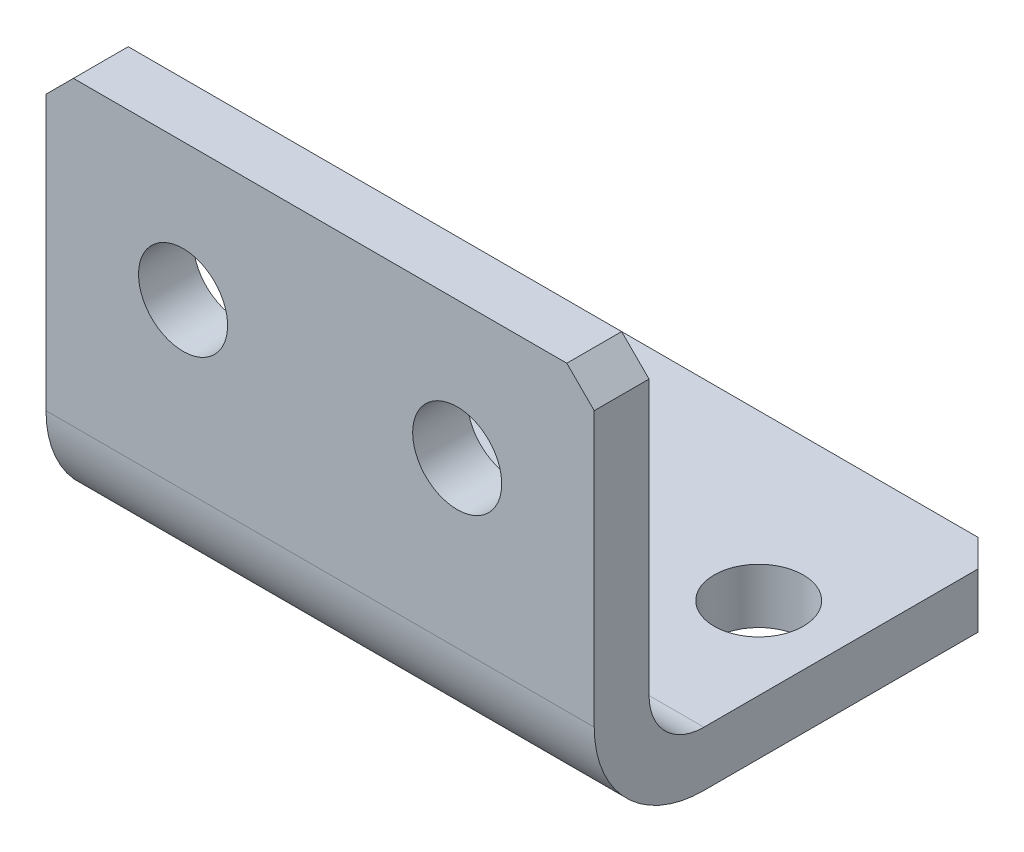
from build123d import *

# Parameters (mm, degrees)
EXTRUDE_1_DEPTH      = 20
EXTRUDE_1_DEPTH_BACK = 20
CUT_EXTRUDE_1_DEPTH  = 4
CUT_EXTRUDE_2_DEPTH  = 4
SKETCH_4_W           = 3.25
SKETCH_4_H           = 9
SKETCH_5_W           = 3.25
SKETCH_5_H           = 9
SKETCH_6_W           = 3.25
SKETCH_6_H           = 9
SKETCH_7_W           = 3.25
SKETCH_7_H           = 9


with BuildPart() as part:
    # ｽｹｯﾁ1 → ﾎﾞｽ - 押し出し1 (new, two sides: drawn at the far end of the back side and taken through both)
    with BuildSketch(Plane(origin=(0, 0, 0), x_dir=(0, 0, -1), z_dir=(1, 0, 0)).offset(-EXTRUDE_1_DEPTH_BACK)):
        with BuildLine():
            Line((8, 0), (30, 0))
            Line((30, 0), (30, 4))
            Line((30, 4), (8, 4))
            ThreePointArc((8, 4), (5.171572875, 5.171572875), (4, 8))
            Line((4, 8), (4, 30))
            Line((4, 30), (0, 30))
            Line((0, 30), (0, 8))
            ThreePointArc((0, 8), (2.343145751, 2.343145751), (8, 0))
        make_face()
    extrude(amount=EXTRUDE_1_DEPTH + EXTRUDE_1_DEPTH_BACK)

    # ｽｹｯﾁ2 → ｶｯﾄ - 押し出し1 (cut)
    with BuildSketch(Plane.XY):
        Polygon((-22, 32), (-22, 27), (-20, 27), (-20, 28), (-18, 30), (18, 30), (20, 28), (20, 27), (22, 27), (22, 32), align=None)
    extrude(amount=-CUT_EXTRUDE_1_DEPTH, mode=Mode.SUBTRACT)

    # ｽｹｯﾁ3 → ｶｯﾄ - 押し出し2 (cut)
    with BuildSketch(Plane(origin=(0, 0, 0), x_dir=(1, 0, 0), z_dir=(0, 1, 0))):
        Polygon((-22, 32), (-22, 27), (-20, 27), (-20, 28), (-18, 30), (18, 30), (20, 28), (20, 27), (22, 27), (22, 32), align=None)
    extrude(amount=CUT_EXTRUDE_2_DEPTH, mode=Mode.SUBTRACT)

    # ｽｹｯﾁ4 → ｶｯﾄ - 回転1 (revolve, cut)
    with BuildSketch(Plane(origin=(0, 20, 0), x_dir=(1, 0, 0), z_dir=(0, 1, 0))):
        with Locations((11.625, 4.5)):
            Rectangle(SKETCH_4_W, SKETCH_4_H)
    revolve(axis=Axis((10, 20, 0), (0, 0, -1)), mode=Mode.SUBTRACT)

    # ｽｹｯﾁ5 → ｶｯﾄ - 回転2 (revolve, cut)
    with BuildSketch(Plane(origin=(0, 20, 0), x_dir=(1, 0, 0), z_dir=(0, 1, 0))):
        with Locations((-8.375, 4.5)):
            Rectangle(SKETCH_5_W, SKETCH_5_H)
    revolve(axis=Axis((-10, 20, 0), (0, 0, -1)), mode=Mode.SUBTRACT)

    # ｽｹｯﾁ6 → ｶｯﾄ - 回転3 (revolve, cut)
    with BuildSketch(Plane.XY.offset(-18)):
        with Locations((15.625, 4.5)):
            Rectangle(SKETCH_6_W, SKETCH_6_H)
    revolve(axis=Axis((14, 0, -18), (0, 1, 0)), mode=Mode.SUBTRACT)

    # ｽｹｯﾁ7 → ｶｯﾄ - 回転4 (revolve, cut)
    with BuildSketch(Plane.XY.offset(-18)):
        with Locations((-12.375, 4.5)):
            Rectangle(SKETCH_7_W, SKETCH_7_H)
    revolve(axis=Axis((-14, 0, -18), (0, 1, 0)), mode=Mode.SUBTRACT)


solid = part.part
